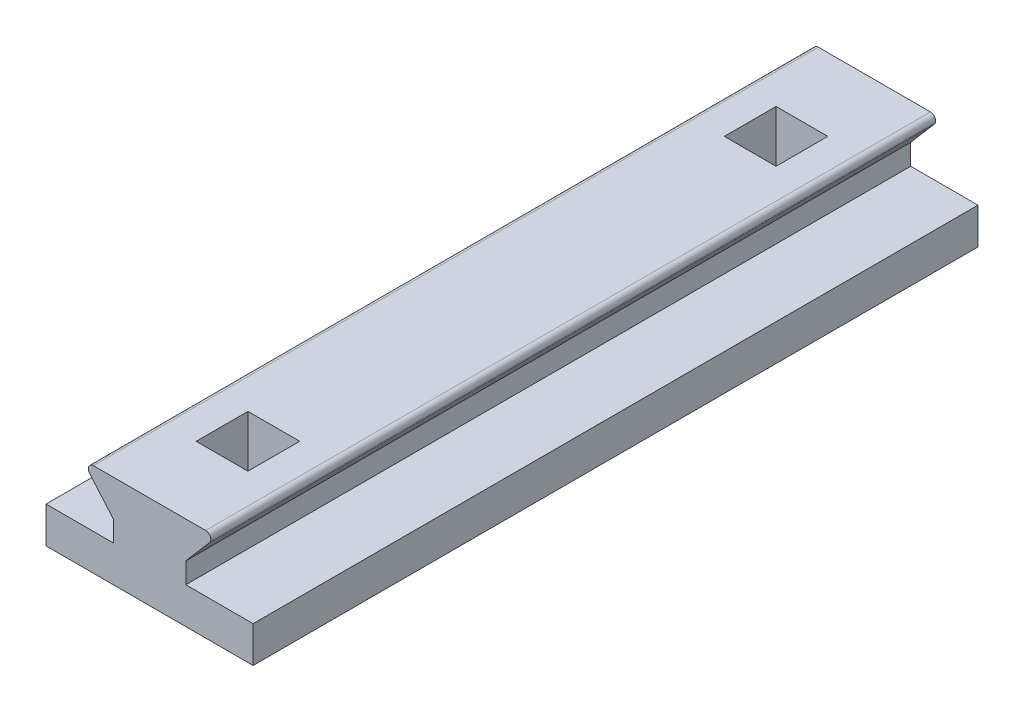
from build123d import *

# Parameters (mm, degrees)
BOSS_EXTRUDE1_DEPTH = 70
FILLET3_R           = 0.5
FILLET4_R           = 0.5
SKETCH2_W           = 5
SKETCH2_H           = 5
CUT_EXTRUDE1_DEPTH  = 5
SKETCH3_R           = 2
CUT_EXTRUDE2_DEPTH  = 73.972597597


with BuildPart() as part:
    # Sketch1 → Boss-Extrude1 (new body)
    with BuildSketch(Plane.XY):
        Polygon((0, 0), (20, 0), (20, 3.5), (13.5, 3.5), (13.5, 5.5), (16.5, 9), (3.5, 9), (6.5, 5.5), (6.5, 3.5), (0, 3.5), align=None)
    extrude(amount=BOSS_EXTRUDE1_DEPTH)

    # Fillet3
    fillet3_edges = [part.edges().sort_by_distance(p)[0] for p in [
        (16.5, 9, 35),
    ]]
    fillet(fillet3_edges, radius=FILLET3_R)

    # Fillet4
    fillet4_edges = [part.edges().sort_by_distance(p)[0] for p in [
        (3.5, 9, 35),
    ]]
    fillet(fillet4_edges, radius=FILLET4_R)

    # Sketch2 → Cut-Extrude1 (cut)
    with BuildSketch(Plane(origin=(0, 9, 0), x_dir=(1, 0, 0), z_dir=(0, 1, 0))):
        with Locations((10, -9.5)):
            Rectangle(SKETCH2_W, SKETCH2_H)
        with Locations((10, -60.5)):
            Rectangle(SKETCH2_W, SKETCH2_H)
    extrude(amount=-CUT_EXTRUDE1_DEPTH, mode=Mode.SUBTRACT)

    # Sketch3 → Cut-Extrude2 (cut, through all)
    with BuildSketch(Plane(origin=(0, 4, 0), x_dir=(1, 0, 0), z_dir=(0, 1, 0))):
        with Locations(Location((10, -9.5, 0), (0, 0, 270))):
            Circle(SKETCH3_R)
        with Locations(Location((10, -60.5, 0), (0, 0, 270))):
            Circle(SKETCH3_R)
    extrude(amount=-CUT_EXTRUDE2_DEPTH, mode=Mode.SUBTRACT)


solid = part.part
